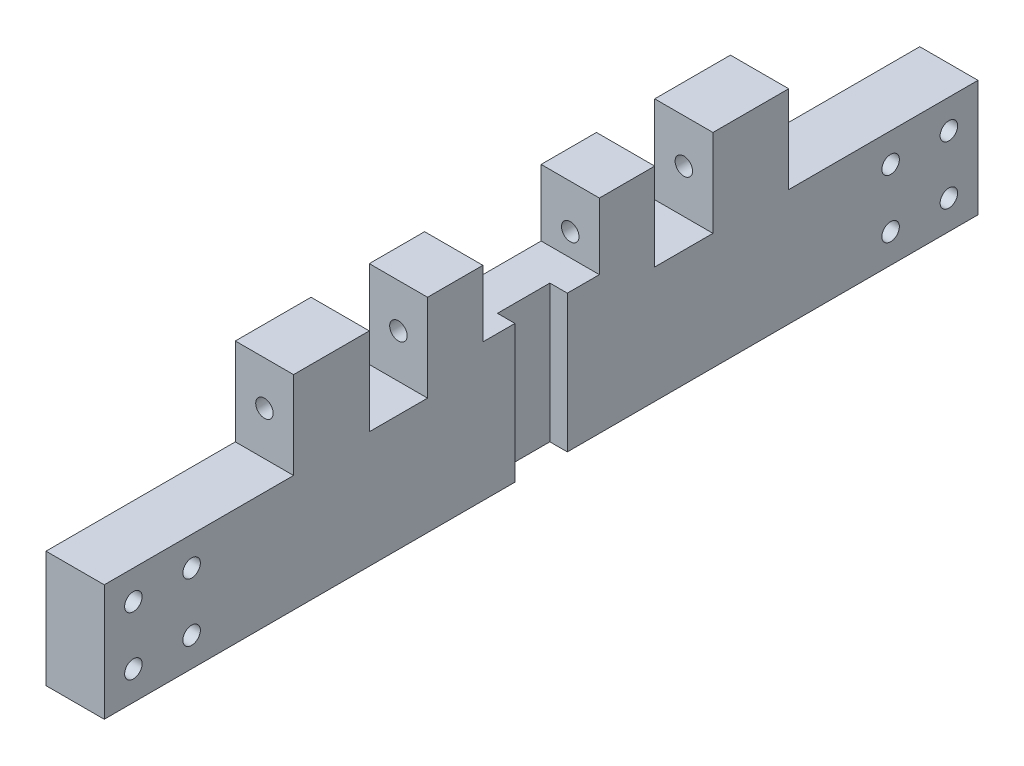
from build123d import *

# Parameters (mm, degrees)
SKETCH_1_W          = 20
SKETCH_1_H          = 30
EXTRUDE_1_DEPTH     = 10
SKETCH_3_W          = 10
SKETCH_3_H          = 20
EXTRUDE_2_DEPTH     = 65
SKETCH_4_R          = 1.5
CUT_EXTRUDE_1_DEPTH = 78.136243103
SKETCH_5_W          = 9
SKETCH_5_H          = 30
CUT_EXTRUDE_2_DEPTH = 3
SKETCH_6_W          = 13
SKETCH_6_H          = 15
EXTRUDE_3_DEPTH     = 10
SKETCH_7_R          = 1.5
CUT_EXTRUDE_5_DEPTH = 121.841532616
SKETCH_8_W          = 20
SKETCH_8_H          = 20
CUT_EXTRUDE_6_DEPTH = 6.389884519


with BuildPart() as part:
    # 草图1 → 凸台-拉伸1 (new body)
    with BuildSketch(Plane(origin=(0, 0, 0), x_dir=(0, 0, -1), z_dir=(1, 0, 0))):
        Rectangle(SKETCH_1_W, SKETCH_1_H)
    extrude(amount=EXTRUDE_1_DEPTH)

    # 草图3 → 凸台-拉伸2 (add)
    with BuildSketch(Plane(origin=(0, 0, -10), x_dir=(-1, 0, 0), z_dir=(0, 0, -1))):
        with Locations((-5, 1.389884519)):
            Rectangle(SKETCH_3_W, SKETCH_3_H)
    extrude_2 = extrude(amount=EXTRUDE_2_DEPTH)

    # 镜向1: 凸台-拉伸2 across plane
    add(extrude_2.mirror(Plane.XY))

    # 草图4 → 切除-拉伸1 (cut, through all)
    with BuildSketch(Plane(origin=(10, 0, 0), x_dir=(0, 0, -1), z_dir=(1, 0, 0))):
        with Locations((-70, 6.389884519)):
            Circle(SKETCH_4_R)
        with Locations((-60, 6.389884519)):
            Circle(SKETCH_4_R)
        with Locations((-70, -3.610115481)):
            Circle(SKETCH_4_R)
        with Locations((-60, -3.610115481)):
            Circle(SKETCH_4_R)
    cut_extrude_1 = extrude(amount=-CUT_EXTRUDE_1_DEPTH, mode=Mode.SUBTRACT)

    # 镜向2: 切除-拉伸1 across plane
    add(cut_extrude_1.mirror(Plane.XY), mode=Mode.SUBTRACT)

    # 草图5 → 切除-拉伸2 (cut)
    with BuildSketch(Plane(origin=(10, 0, 0), x_dir=(0, 0, -1), z_dir=(1, 0, 0))):
        Rectangle(SKETCH_5_W, SKETCH_5_H)
    extrude(amount=-CUT_EXTRUDE_2_DEPTH, mode=Mode.SUBTRACT)

    # 草图6 → 凸台-拉伸3 (add)
    with BuildSketch(Plane(origin=(10, 0, 0), x_dir=(0, 0, -1), z_dir=(1, 0, 0))):
        with Locations((36, 18.889884519)):
            Rectangle(SKETCH_6_W, SKETCH_6_H)
        Polygon((10, 11.389884519), (19.5, 11.389884519), (19.5, 26.389884519), (10, 26.389884519), (10, 15), align=None)
    extrude_3 = extrude(amount=-EXTRUDE_3_DEPTH)

    # 草图7 → 切除-拉伸5 (cut, through all)
    with BuildSketch(Plane(origin=(0, 0, -42.5), x_dir=(-1, 0, 0), z_dir=(0, 0, -1))):
        with Locations((-5, 18.889884519)):
            Circle(SKETCH_7_R)
    cut_extrude_5 = extrude(amount=-CUT_EXTRUDE_5_DEPTH, mode=Mode.SUBTRACT)

    # 镜向4: 凸台-拉伸3, 切除-拉伸5 across plane
    add(extrude_3.mirror(Plane.XY))
    add(cut_extrude_5.mirror(Plane.XY), mode=Mode.SUBTRACT)

    # 草图8 → 切除-拉伸6 (cut)
    with BuildSketch(Plane.XZ.offset(15)):
        Rectangle(SKETCH_8_W, SKETCH_8_H)
    extrude(amount=-CUT_EXTRUDE_6_DEPTH, mode=Mode.SUBTRACT)


solid = part.part
